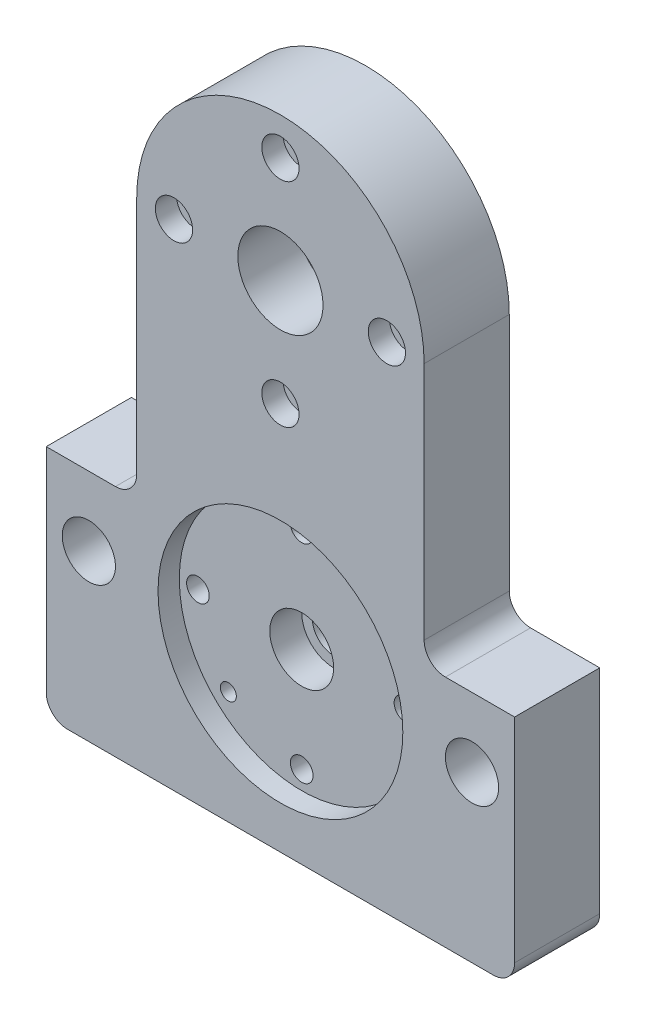
from build123d import *

# Parameters (mm, degrees)
BOLT_CIRCLE_R                                     = 12.7
BOLT_CIRCLE_R_2                                   = 6.35
BASE_DEPTH                                        = 12.7
STRUCTURE_TUBE_CONNECTION_COUNTERBORE_D           = 6.7564
STRUCTURE_TUBE_CONNECTION_COUNTERBORE_CBORE_D     = 11.1125
STRUCTURE_TUBE_CONNECTION_COUNTERBORE_CBORE_DEPTH = 6.35
STRUCTURE_TUBE_CONNECTION_COUNTERBORE_PA_COUNT    = 4
SPINDLE_CONNECTION_COUNTERBORE_D                  = 6.7564
SPINDLE_CONNECTION_COUNTERBORE_CBORE_D            = 11.1125
SPINDLE_CONNECTION_COUNTERBORE_CBORE_DEPTH        = 6.35
SPINDLE_CONNECTION_COUNTERBORE_PATTERN_COUNT      = 4
SKETCH16_R                                        = 36.5125
STRUCTURE_TUBE_MOUNTING_POCKET_DEPTH              = 6.35
SKETCH17_R                                        = 36.5125
SPINDLE_MOUNTING_POCKET_DEPTH                     = 7.62
SKETCH18_R                                        = 9.525
LEAD_SCREW_THROUGH_HOLE_DEPTH                     = 9.525
SKETCH20_R                                        = 7.9375
RAIL_MOUNTING_PILOT_HOLES_DEPTH                   = 166.290695159
SKETCH27_R                                        = 2.38125
ALIGNMENT_FEATURES_DEPTH                          = 6.35
GENERIC_ROUNDING_FILLET_R                         = 6.35


with BuildPart() as part:
    # Bolt circle → Base (new, symmetric)
    with BuildSketch(Plane.XY):
        with BuildLine():
            Line((-42.8625, 0), (-42.8625, -77.7875))
            Line((-42.8625, -77.7875), (-69.85, -77.7875))
            Line((-69.85, -77.7875), (-69.85, -147.6375))
            Line((-69.85, -147.6375), (69.85, -147.6375))
            Line((69.85, -147.6375), (69.85, -77.7875))
            Line((69.85, -77.7875), (42.8625, -77.7875))
            Line((42.8625, -77.7875), (42.8625, 0))
            ThreePointArc((42.8625, 0), (0, 42.8625), (-42.8625, 0))
        make_face()
        Circle(BOLT_CIRCLE_R, mode=Mode.SUBTRACT)
        with Locations((0, -98.425)):
            Circle(BOLT_CIRCLE_R_2, mode=Mode.SUBTRACT)
    extrude(amount=BASE_DEPTH, both=True)

    # Structure tube connection counterbore (through all)
    with Locations(Plane(origin=(0, 0, -12.7), x_dir=(-1, 0, 0), z_dir=(0, 0, -1))):
        with Locations((0, -67.46875)):
            structure_tube_connection_counterbore = CounterBoreHole(STRUCTURE_TUBE_CONNECTION_COUNTERBORE_D / 2, STRUCTURE_TUBE_CONNECTION_COUNTERBORE_CBORE_D / 2, STRUCTURE_TUBE_CONNECTION_COUNTERBORE_CBORE_DEPTH)

    # Structure tube connection counterbore pattern: Structure tube connection counterbore ×4 about axis
    structure_tube_connection_counterbore_pa_axis = Axis((0, -98.425, 12.7), (0, 0, -1))
    for i in range(1, STRUCTURE_TUBE_CONNECTION_COUNTERBORE_PA_COUNT):
        add(structure_tube_connection_counterbore.rotate(structure_tube_connection_counterbore_pa_axis, i * 360 / STRUCTURE_TUBE_CONNECTION_COUNTERBORE_PA_COUNT), mode=Mode.SUBTRACT)

    # Spindle connection counterbore (through all)
    with Locations(Plane.XY.offset(12.7)):
        with Locations((0, 31.75)):
            spindle_connection_counterbore = CounterBoreHole(SPINDLE_CONNECTION_COUNTERBORE_D / 2, SPINDLE_CONNECTION_COUNTERBORE_CBORE_D / 2, SPINDLE_CONNECTION_COUNTERBORE_CBORE_DEPTH)

    # Spindle connection counterbore pattern: Spindle connection counterbore ×4 about axis
    spindle_connection_counterbore_pattern_axis = Axis((0, 0, 12.7), (0, 0, -1))
    for i in range(1, SPINDLE_CONNECTION_COUNTERBORE_PATTERN_COUNT):
        add(spindle_connection_counterbore.rotate(spindle_connection_counterbore_pattern_axis, i * 360 / SPINDLE_CONNECTION_COUNTERBORE_PATTERN_COUNT), mode=Mode.SUBTRACT)

    # Sketch16 → Structure tube mounting pocket (cut)
    with BuildSketch(Plane.XY.offset(12.7)):
        with Locations((0, -98.425)):
            Circle(SKETCH16_R)
    extrude(amount=-STRUCTURE_TUBE_MOUNTING_POCKET_DEPTH, mode=Mode.SUBTRACT)

    # Sketch17 → Spindle mounting pocket (cut)
    with BuildSketch(Plane(origin=(0, 0, -12.7), x_dir=(-1, 0, 0), z_dir=(0, 0, -1))):
        Circle(SKETCH17_R)
    extrude(amount=-SPINDLE_MOUNTING_POCKET_DEPTH, mode=Mode.SUBTRACT)

    # Sketch18 → Lead screw through hole (cut)
    with BuildSketch(Plane.XY.offset(6.35)):
        with Locations((0, -98.425)):
            Circle(SKETCH18_R)
    extrude(amount=-LEAD_SCREW_THROUGH_HOLE_DEPTH, mode=Mode.SUBTRACT)

    # Sketch20 → Rail mounting pilot_holes (cut, through all)
    with BuildSketch(Plane.XY.offset(12.7)):
        with Locations((57.15, -98.425)):
            Circle(SKETCH20_R)
        with Locations((-57.15, -98.425)):
            Circle(SKETCH20_R)
    extrude(amount=-RAIL_MOUNTING_PILOT_HOLES_DEPTH, mode=Mode.SUBTRACT)

    # Sketch27 → Alignment_features (cut)
    with BuildSketch(Plane.XY.offset(6.35)):
        with Locations((-21.889374295, -120.314374295)):
            Circle(SKETCH27_R)
        with BuildLine():
            Line((20.681324246, -74.335397148), (19.602797121, -75.500272889))
            ThreePointArc((19.602797121, -75.500272889), (19.732320046, -78.865377187), (23.097424344, -78.735854262))
            Line((23.097424344, -78.735854262), (24.175951469, -77.570978521))
            ThreePointArc((24.175951469, -77.570978521), (24.046428544, -74.205874223), (20.681324246, -74.335397148))
        make_face()
    extrude(amount=-ALIGNMENT_FEATURES_DEPTH, mode=Mode.SUBTRACT)

    # Generic_rounding_fillet
    generic_rounding_fillet_edges = [part.edges().sort_by_distance(p)[0] for p in [
        (42.8625, -77.7875, 0),
        (-42.8625, -77.7875, 0),
        (-69.85, -147.6375, 0),
        (69.85, -147.6375, 0),
    ]]
    fillet(generic_rounding_fillet_edges, radius=GENERIC_ROUNDING_FILLET_R)


solid = part.part
